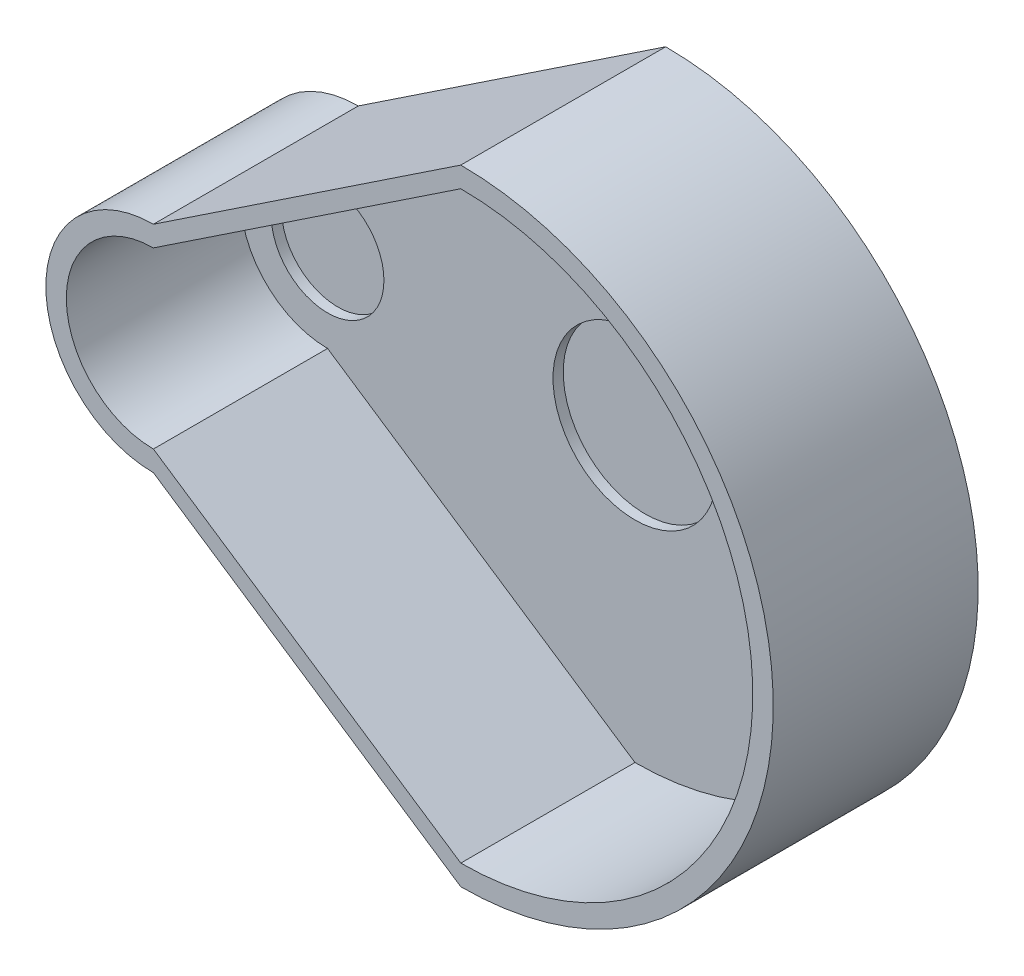
from build123d import *

# Parameters (mm, degrees)
BOSS_EXTRU_1_DEPTH           = 20
ENL_V_MAT_EXTRU_1_DEPTH      = 34
ENL_V_MAT_EXTRU_2_DEPTH      = 140.70683591
ENL_V_MAT_EXTRU_2_DEPTH_BACK = 2
ESQUISSE3_R                  = 11
ESQUISSE3_R_2                = 16


with BuildPart() as part:
    # Esquisse1 → Boss.-Extru.1 (new, symmetric)
    with BuildSketch(Plane.XY):
        with BuildLine():
            Line((0, 21), (60, 61))
            ThreePointArc((60, 61), (121, 0), (60, -61))
            Line((60, -61), (0, -21))
            ThreePointArc((0, -21), (-21, 0), (0, 21))
        make_face()
    extrude(amount=BOSS_EXTRU_1_DEPTH, both=True)

    # Esquisse2 → Enlèv. mat.-Extru.1 (cut)
    with BuildSketch(Plane.XY.offset(20)):
        with BuildLine():
            Line((0, 17), (60, 57))
            ThreePointArc((60, 57), (117, 0), (60, -57))
            Line((60, -57), (0, -17))
            ThreePointArc((0, -17), (-17, 0), (0, 17))
        make_face()
    extrude(amount=-ENL_V_MAT_EXTRU_1_DEPTH, mode=Mode.SUBTRACT)

    # Esquisse3 → Enlèv. mat.-Extru.2 (cut, two sides: drawn at the far end of the back side and taken through both)
    with BuildSketch(Plane.XY.offset(-14).offset(-ENL_V_MAT_EXTRU_2_DEPTH_BACK)):
        Circle(ESQUISSE3_R)
        with Locations((60, 0)):
            Circle(ESQUISSE3_R_2)
    extrude(amount=ENL_V_MAT_EXTRU_2_DEPTH + ENL_V_MAT_EXTRU_2_DEPTH_BACK, mode=Mode.SUBTRACT)


solid = part.part
